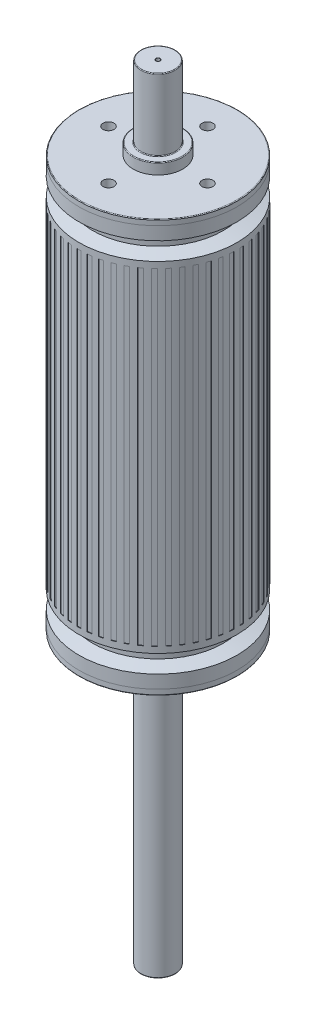
from build123d import *

# Parameters (mm, degrees)
SKETCH3_W          = 3
SKETCH3_H          = 0.8
CUT_EXTRUDE2_DEPTH = 238
CIRPATTERN1_COUNT  = 50
SKETCH4_R          = 4
CUT_EXTRUDE3_DEPTH = 50
FILLET1_R          = 0.5
SKETCH5_R          = 1.5
CUT_EXTRUDE4_DEPTH = 4
SKETCH6_R          = 2
CUT_EXTRUDE5_DEPTH = 4
FILLET2_R          = 1
FILLET3_R          = 0.1


with BuildPart() as part:
    # Sketch1 → Revolve1 (revolve)
    with BuildSketch(Plane.XY):
        Polygon((0, 390), (0, -180), (12.5, -180), (12.5, 22), (18, 22), (18, 30), (57.5, 30), (57.5, 43.5), (47.5, 46), (47.5, 54), (57.5, 56.5), (57.5, 303.5), (47.5, 306), (47.5, 314), (57.5, 316.5), (57.5, 330), (18, 330), (18, 338), (12.5, 338), (12.5, 390), align=None)
    revolve(axis=Axis((0, 0, 0), (0, 1, 0)))

    # Sketch3 → Cut-Extrude2 (cut)
    with BuildSketch(Plane(origin=(0, 61, 0), x_dir=(1, 0, 0), z_dir=(0, 1, 0))):
        with Locations((0, 57.5)):
            Rectangle(SKETCH3_W, SKETCH3_H)
    cut_extrude2 = extrude(amount=CUT_EXTRUDE2_DEPTH, mode=Mode.SUBTRACT)

    # CirPattern1: Cut-Extrude2 ×50 about axis
    cirpattern1_axis = Axis((0, 0, 0), (0, 1, 0))
    for i in range(1, CIRPATTERN1_COUNT):
        add(cut_extrude2.rotate(cirpattern1_axis, i * 360 / CIRPATTERN1_COUNT), mode=Mode.SUBTRACT)

    # Sketch4 → Cut-Extrude3 (cut)
    with BuildSketch(Plane.XZ.offset(-30)):
        with Locations(Location((0, 36, 0), (0, 0, 270))):
            Circle(SKETCH4_R)
        with Locations(Location((36, 0, 0), (0, 0, 270))):
            Circle(SKETCH4_R)
        with Locations(Location((0, -36, 0), (0, 0, 270))):
            Circle(SKETCH4_R)
        with Locations(Location((-36, 0, 0), (0, 0, 270))):
            Circle(SKETCH4_R)
    cut_extrude3 = extrude(amount=-CUT_EXTRUDE3_DEPTH, mode=Mode.SUBTRACT)

    # Fillet1
    fillet1_edges = [part.edges().sort_by_distance(p)[0] for p in [
        (-12.5, 390, 0),
        (-12.5, 338, 0),
        (-18, 338, 0),
        (-57.5, 330, 0),
        (-57.5, 30, 0),
        (-18, 30, 0),
        (-18, 22, 0),
        (-12.5, 22, 0),
        (-12.5, -180, 0),
    ]]
    fillet(fillet1_edges, radius=FILLET1_R)

    # Mirror1: Cut-Extrude3 across plane
    add(cut_extrude3.mirror(Plane.ZX.offset(180)), mode=Mode.SUBTRACT)

    # Sketch5 → Cut-Extrude4 (cut)
    with BuildSketch(Plane(origin=(0, 390, 0), x_dir=(1, 0, 0), z_dir=(0, 1, 0))):
        with Locations(Location((0, 0, 0), (0, 0, 180))):
            Circle(SKETCH5_R)
    extrude(amount=-CUT_EXTRUDE4_DEPTH, mode=Mode.SUBTRACT)

    # Sketch6 → Cut-Extrude5 (cut)
    with BuildSketch(Plane.XZ.offset(180)):
        Circle(SKETCH6_R)
    extrude(amount=-CUT_EXTRUDE5_DEPTH, mode=Mode.SUBTRACT)

    # Fillet2
    fillet2_edges = [part.edges().sort_by_distance(p)[0] for p in [
        (1.5, 386, 0),
        (-2, -176, 0),
    ]]
    fillet(fillet2_edges, radius=FILLET2_R)

    # Fillet3
    fillet3_edges = [part.edges().sort_by_distance(p)[0] for p in [
        (1.5, 390, 0),
        (-2, -180, 0),
    ]]
    fillet(fillet3_edges, radius=FILLET3_R)


solid = part.part
